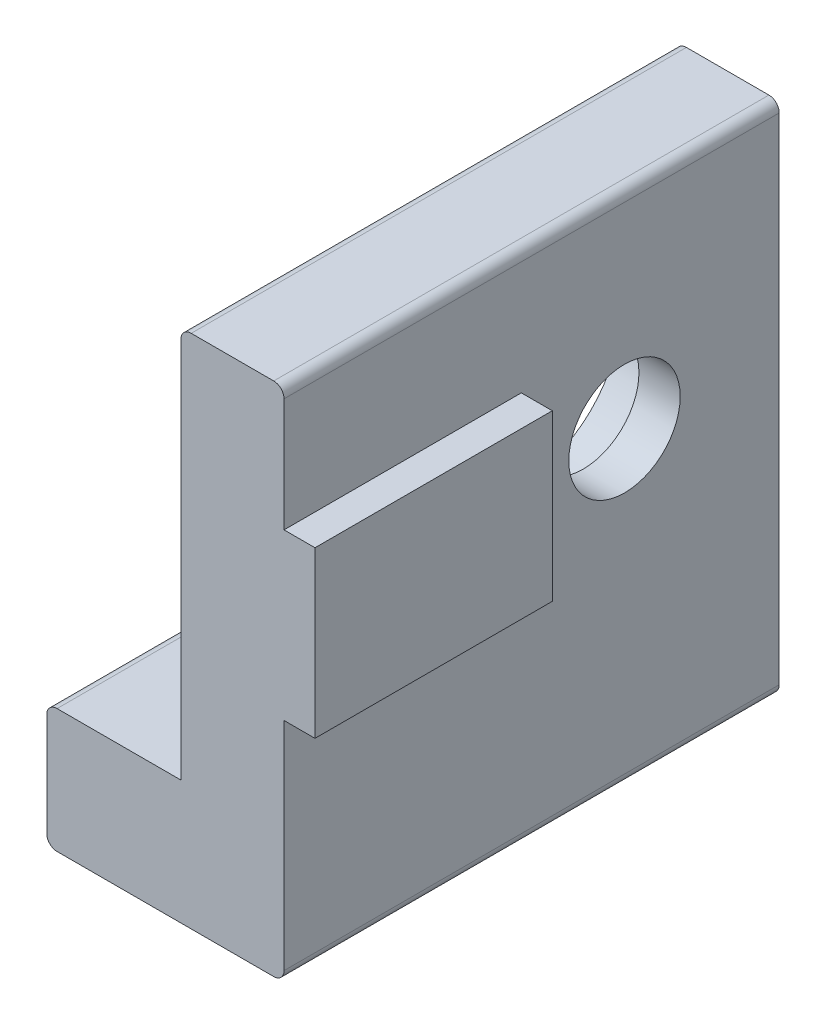
from build123d import *

# Parameters (mm, degrees)
BOSS_EXTRUDE1_DEPTH = 24
CUT_EXTRUDE1_REACH  = 37.26
SKETCH2_R           = 1.25
SKETCH2_W           = 1.5
SKETCH2_H           = 12.5
SKETCH3_R           = 2.7
CUT_EXTRUDE2_DEPTH  = 28.8298401
SKETCH4_R           = 4.8
CUT_EXTRUDE3_DEPTH  = 3
FILLET1_R           = 0.5
CUT_EXTRUDE4_DEPTH  = 3.6


with BuildPart() as part:
    # Sketch1 → Boss-Extrude1 (new body)
    with BuildSketch(Plane.XY):
        Polygon((5, 12.5), (0, 12.5), (0, -6.5), (-6.5, -6.5), (-6.5, -12.5), (5, -12.5), (5, -1.5), (6.5, -1.5), (6.5, 6.5), (5, 6.5), align=None)
    extrude(amount=BOSS_EXTRUDE1_DEPTH)

    # Sketch2 → Cut-Extrude1 (cut, up to next)
    with BuildSketch(Plane.XZ.offset(12.5), mode=Mode.PRIVATE) as cut_extrude1_sk1:
        with Locations((-3, 19)):
            Circle(SKETCH2_R)
    cut_extrude1_tool1 = extrude(cut_extrude1_sk1.sketch, amount=-CUT_EXTRUDE1_REACH, mode=Mode.PRIVATE) & part.part
    # Sketch2 → Cut-Extrude1 (cut, up to next)
    with BuildSketch(Plane.XZ.offset(12.5), mode=Mode.PRIVATE) as cut_extrude1_sk2:
        with Locations((5.75, 6.25)):
            Rectangle(SKETCH2_W, SKETCH2_H)
    cut_extrude1_tool2 = extrude(cut_extrude1_sk2.sketch, amount=-CUT_EXTRUDE1_REACH, mode=Mode.PRIVATE) & part.part
    # Sketch2 → Cut-Extrude1 (cut, up to next)
    with BuildSketch(Plane.XZ.offset(12.5), mode=Mode.PRIVATE) as cut_extrude1_sk3:
        Polygon((0, 0), (-6.5, 14), (-6.5, 0), align=None)
    cut_extrude1_tool3 = extrude(cut_extrude1_sk3.sketch, amount=-CUT_EXTRUDE1_REACH, mode=Mode.PRIVATE) & part.part
    add(cut_extrude1_tool1.solids().sort_by_distance((-3, -12.5, 19))[0], mode=Mode.SUBTRACT)
    add(cut_extrude1_tool2.solids().sort_by_distance((5.75, -12.5, 6.25))[0], mode=Mode.SUBTRACT)
    add(cut_extrude1_tool3.solids().sort_by_distance((-4.333333, -12.5, 4.666667))[0], mode=Mode.SUBTRACT)

    # Sketch3 → Cut-Extrude2 (cut, through all)
    with BuildSketch(Plane.ZY):
        with Locations((7.5, 2.5)):
            Circle(SKETCH3_R)
    extrude(amount=-CUT_EXTRUDE2_DEPTH, mode=Mode.SUBTRACT)

    # Sketch4 → Cut-Extrude3 (cut)
    with BuildSketch(Plane.ZY):
        with Locations((7.5, 2.5)):
            Circle(SKETCH4_R)
    extrude(amount=-CUT_EXTRUDE3_DEPTH, mode=Mode.SUBTRACT)

    # Fillet1
    fillet1_edges = [part.edges().sort_by_distance(p)[0] for p in [
        (5, -12.5, 12),
        (0, 12.5, 12),
        (5, 12.5, 12),
        (-6.5, -12.5, 19),
        (-3.25, -12.5, 7),
        (-6.5, -6.5, 19),
        (-3.25, -6.5, 7),
    ]]
    fillet(fillet1_edges, radius=FILLET1_R)

    # Sketch6 → Cut-Extrude4 (cut)
    with BuildSketch(Plane(origin=(0, 0, 12), x_dir=(-1, 0, 0), z_dir=(0, 0, -1))):
        with BuildLine():
            Line((0, 7.69614), (0, 9.48283))
            ThreePointArc((0, 9.48283), (-4.6, 2.5), (0, -4.48283))
            Line((0, -4.48283), (0, -2.69614))
            ThreePointArc((0, -2.69614), (-2.999993872, 2.5), (0, 7.69614))
        make_face()
    extrude(amount=-CUT_EXTRUDE4_DEPTH, mode=Mode.SUBTRACT)


solid = part.part
